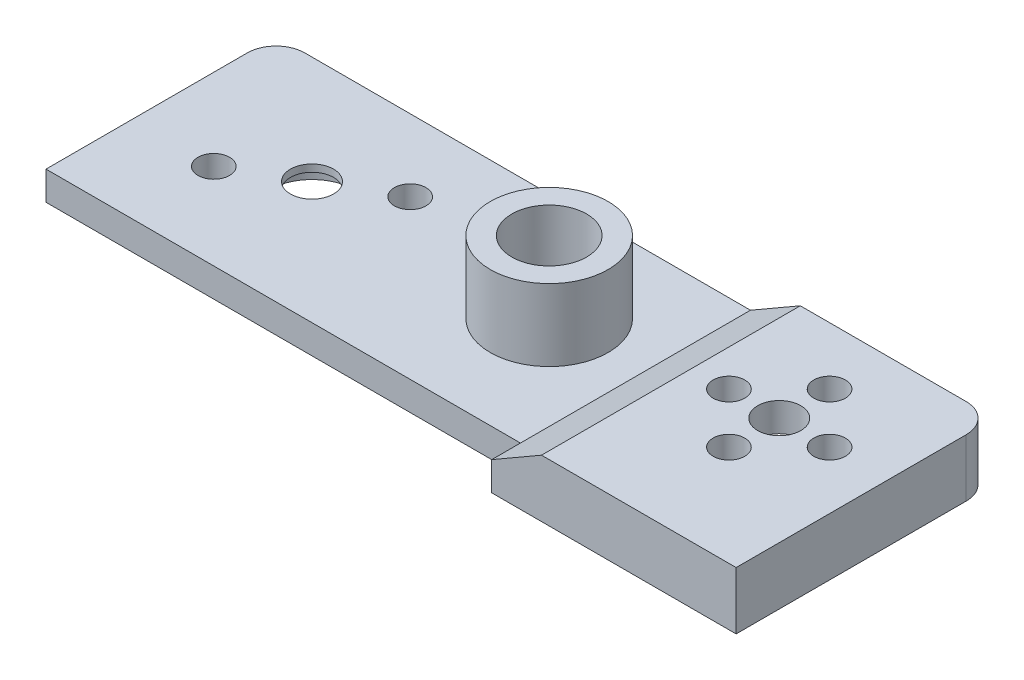
from build123d import *
from build123d.topology import SkipClean

# Parameters (mm, degrees)
SKETCH_1_W          = 50
SKETCH_1_H          = 15
SKETCH_1_R          = 1.1
SKETCH_1_R_2        = 1.5
SKETCH_1_R_3        = 2.6
EXTRUDE_1_DEPTH     = 2
SKETCH_3_R          = 3
CUT_EXTRUDE_1_DEPTH = 1.5
SKETCH_1_7_W        = 17
SKETCH_1_7_H        = 15
SKETCH_1_7_R        = 1.5
SKETCH_1_7_R_2      = 1.1
EXTRUDE_4_DEPTH     = 4
SKETCH_1_8_R        = 6
SKETCH_1_8_R_2      = 1.5
SKETCH_1_8_R_3      = 1.1
CUT_EXTRUDE_4_DEPTH = 2
CUT_EXTRUDE_5_DEPTH = 15
EXTRUDE_START       = 2
SKETCH_8_R          = 5.5
SKETCH_8_R_2        = 2.6
EXTRUDE_11_DEPTH    = 2
CUT_EXTRUDE_6_DEPTH = 3.5
CUT_EXTRUDE_7_DEPTH = 2
FILLET_1_R          = 2
EXTRUDE_15_DEPTH    = 1
EXTRUDE_16_DEPTH    = 2
SKETCH_16_R         = 4.1
SKETCH_16_R_2       = 2.6
EXTRUDE_18_DEPTH    = 5
FILLET_3_R          = 0.5


with BuildPart() as part:
    # 草图1 → 凸台-拉伸1 (new body)
    with BuildSketch(Plane(origin=(0, 0, 0), x_dir=(1, 0, 0), z_dir=(0, 1, 0))):
        Rectangle(SKETCH_1_W, SKETCH_1_H)
        with BuildLine():
            ThreePointArc((8, 2.598076211), (8.5, 0), (8, -2.598076211))
            Line((8, -2.598076211), (8, 2.598076211))
        make_face(mode=Mode.SUBTRACT)
        with Locations(Location((-19.330127019, -2.5, 0), (0, 0, 270))):
            Circle(SKETCH_1_R, mode=Mode.SUBTRACT)
        with Locations(Location((-15, 0, 0), (0, 0, 270))):
            Circle(SKETCH_1_R_2, mode=Mode.SUBTRACT)
        with Locations(Location((-10.669872981, 2.5, 0), (0, 0, 270))):
            Circle(SKETCH_1_R, mode=Mode.SUBTRACT)
        with Locations(Location((1.5, 0, 0), (0, 0, 270))):
            Circle(SKETCH_1_R_3, mode=Mode.SUBTRACT)
        with Locations(Location((17.5, 3.5, 0), (0, 0, 270))):
            Circle(SKETCH_1_R, mode=Mode.SUBTRACT)
        with Locations(Location((17.5, -3.5, 0), (0, 0, 270))):
            Circle(SKETCH_1_R, mode=Mode.SUBTRACT)
        with Locations(Location((14, 0, 0), (0, 0, 270))):
            Circle(SKETCH_1_R, mode=Mode.SUBTRACT)
        with Locations(Location((17.5, 0, 0), (0, 0, 270))):
            Circle(SKETCH_1_R_2, mode=Mode.SUBTRACT)
        with Locations(Location((21, 0, 0), (0, 0, 270))):
            Circle(SKETCH_1_R, mode=Mode.SUBTRACT)
    extrude(amount=EXTRUDE_1_DEPTH)

    # 草图3 → 切除-拉伸1 (cut)
    with BuildSketch(Plane.XZ):
        with Locations(Location((-15, 0, 0), (0, 0, 270))):
            Circle(SKETCH_3_R)
    extrude(amount=-CUT_EXTRUDE_1_DEPTH, mode=Mode.SUBTRACT)

    # 草图1<7> → 凸台-拉伸4 (add)
    with BuildSketch(Plane(origin=(0, 0, 0), x_dir=(1, 0, 0), z_dir=(0, 1, 0))):
        with Locations((16.5, 0)):
            Rectangle(SKETCH_1_7_W, SKETCH_1_7_H)
        with Locations(Location((17.5, 0, 0), (0, 0, 270))):
            Circle(SKETCH_1_7_R, mode=Mode.SUBTRACT)
        with Locations(Location((21, 0, 0), (0, 0, 270))):
            Circle(SKETCH_1_7_R_2, mode=Mode.SUBTRACT)
        with Locations(Location((17.5, -3.5, 0), (0, 0, 270))):
            Circle(SKETCH_1_7_R_2, mode=Mode.SUBTRACT)
        with Locations(Location((14, 0, 0), (0, 0, 270))):
            Circle(SKETCH_1_7_R_2, mode=Mode.SUBTRACT)
        with Locations(Location((17.5, 3.5, 0), (0, 0, 270))):
            Circle(SKETCH_1_7_R_2, mode=Mode.SUBTRACT)
    extrude(amount=EXTRUDE_4_DEPTH)

    # 草图1<8> → 切除-拉伸4 (cut)
    with BuildSketch(Plane(origin=(0, 0, 0), x_dir=(1, 0, 0), z_dir=(0, 1, 0))):
        with Locations(Location((17.5, 0, 0), (0, 0, 270))):
            Circle(SKETCH_1_8_R)
        with Locations(Location((17.5, 0, 0), (0, 0, 270))):
            Circle(SKETCH_1_8_R_2, mode=Mode.SUBTRACT)
        with Locations(Location((21, 0, 0), (0, 0, 270))):
            Circle(SKETCH_1_8_R_3, mode=Mode.SUBTRACT)
        with Locations(Location((17.5, -3.5, 0), (0, 0, 270))):
            Circle(SKETCH_1_8_R_3, mode=Mode.SUBTRACT)
        with Locations(Location((14, 0, 0), (0, 0, 270))):
            Circle(SKETCH_1_8_R_3, mode=Mode.SUBTRACT)
        with Locations(Location((17.5, 3.5, 0), (0, 0, 270))):
            Circle(SKETCH_1_8_R_3, mode=Mode.SUBTRACT)
    extrude(amount=CUT_EXTRUDE_4_DEPTH, mode=Mode.SUBTRACT)

    # 草图6 → 切除-拉伸5 (cut)
    with BuildSketch(Plane(origin=(0, 0, -7.5), x_dir=(-1, 0, 0), z_dir=(0, 0, -1))):
        Polygon((-8, 2), (-11.464101615, 4), (-8, 4), align=None)
    extrude(amount=-CUT_EXTRUDE_5_DEPTH, mode=Mode.SUBTRACT)

    # 草图8 → 凸台-拉伸11 (add)
    with SkipClean():  # the faces are left unmerged after this step: merging them gives an invalid solid
        with BuildSketch(Plane.XZ.offset(EXTRUDE_START)):
            with Locations(Location((1.5, 0, 0), (0, 0, 90))):
                Circle(SKETCH_8_R)
            with Locations(Location((1.5, 0, 0), (0, 0, 270))):
                Circle(SKETCH_8_R_2, mode=Mode.SUBTRACT)
        extrude(amount=-EXTRUDE_11_DEPTH)

    # 草图10 → 切除-拉伸6 (cut)
    with BuildSketch(Plane.XZ.offset(2)):
        Polygon((1.5, 3.175426481), (-1.25, 1.58771324), (-1.25, -1.58771324), (1.5, -3.175426481), (4.25, -1.58771324), (4.25, 1.58771324), align=None)
    extrude(amount=-CUT_EXTRUDE_6_DEPTH, mode=Mode.SUBTRACT)

    # 草图11 → 切除-拉伸7 (cut)
    with BuildSketch(Plane.XZ.offset(2)):
        with BuildLine():
            Line((-3.398979486, 2.5), (6.398979486, 2.5))
            ThreePointArc((6.398979486, 2.5), (1.5, 5.5), (-3.398979486, 2.5))
        make_face()
    extrude(amount=-CUT_EXTRUDE_7_DEPTH, mode=Mode.SUBTRACT)

    # 圆角1
    fillet_1_edges = [part.edges().sort_by_distance(p)[0] for p in [
        (-25, 1, -7.5),
        (25, 2, -7.5),
    ]]
    fillet(fillet_1_edges, radius=FILLET_1_R)

    # 草图13 → 凸台-拉伸15 (add)
    with BuildSketch(Plane.XY.offset(7.5)):
        Polygon((11.464101615, 4), (8, 2), (-25, 2), (-25, 0), (25, 0), (25, 4), align=None)
    extrude(amount=EXTRUDE_15_DEPTH)

    # 草图14 → 凸台-拉伸16 (add)
    with BuildSketch(Plane.XY.offset(8.5)):
        Polygon((8, 0), (8, 2), (11.464101615, 4), (25, 4), (25, 0), align=None)
    extrude(amount=EXTRUDE_16_DEPTH)

    # 草图16 → 凸台-拉伸18 (add)
    with BuildSketch(Plane(origin=(0, 2, 0), x_dir=(1, 0, 0), z_dir=(0, 1, 0))):
        with Locations(Location((1.5, 0, 0), (0, 0, 270))):
            Circle(SKETCH_16_R)
        with Locations(Location((1.5, 0, 0), (0, 0, 90))):
            Circle(SKETCH_16_R_2, mode=Mode.SUBTRACT)
    extrude(amount=EXTRUDE_18_DEPTH)

    # 圆角3
    fillet_3_edges = [part.edges().sort_by_distance(p)[0] for p in [
        (4.25, -2, 0),
        (3.459936491, -2, 2.04385662),
        (-1.25, -2, 0),
        (0.125, -2, -2.38156986),
        (2.875, -2, -2.38156986),
        (-0.459936491, -2, 2.04385662),
        (1.5, -2, -5.5),
        (4.534426233, -2, 2.5),
        (-1.534426233, -2, 2.5),
    ]]
    fillet(fillet_3_edges, radius=FILLET_3_R)


solid = part.part
